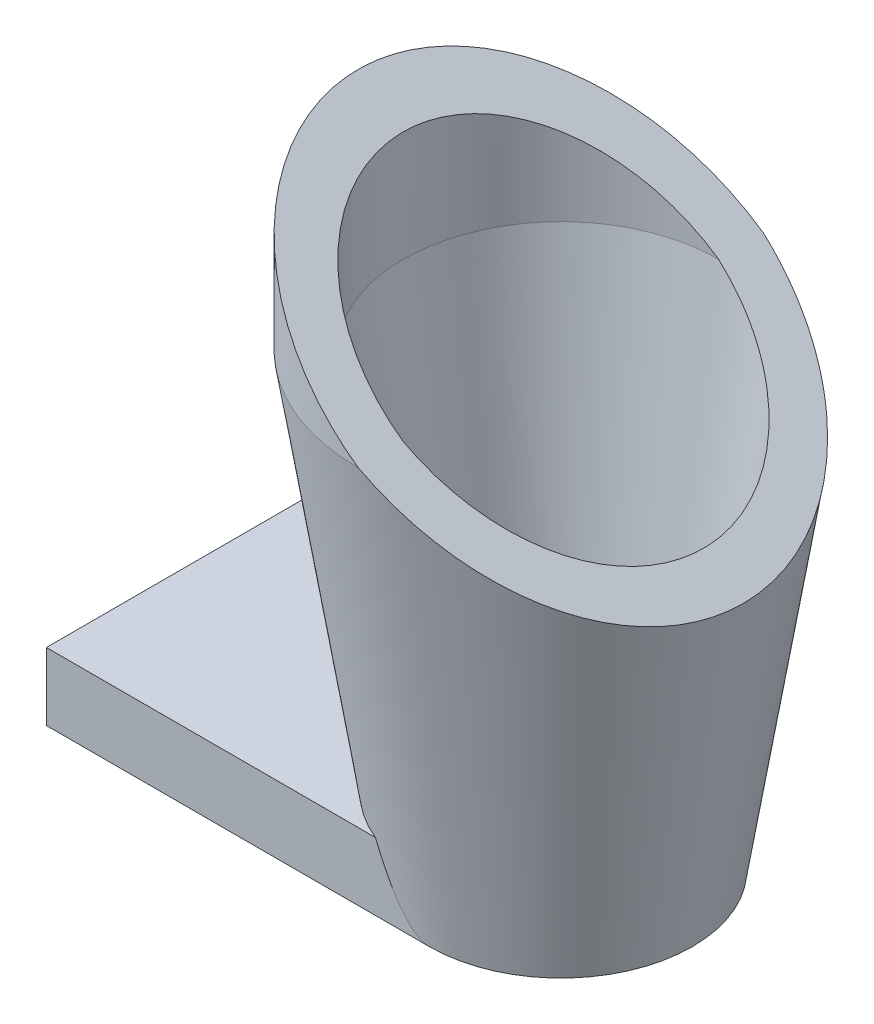
from build123d import *

# Parameters (mm, degrees)
SKETCH1_R                     = 9
BOSS_EXTRUDE1_DEPTH           = 20
BOSS_EXTRUDE1_TAPER           = 9
BOSS_EXTRUDE1_OTHER_WAY_DEPTH = 30
SKETCH1_4_R                   = 7
SKETCH2_R                     = 4
SKETCH1_5_R                   = 7
CUT_EXTRUDE1_DEPTH            = 5
BOSS_EXTRUDE3_DEPTH           = 3


with BuildPart() as part:
    # Sketch1 → Boss-Extrude1 (new body)
    with BuildSketch(Plane(origin=(0, 0, 0), x_dir=(1, 0, 0), z_dir=(0, 1, 0))):
        with Locations(Location((0, 0, 0), (0, 0, 270))):
            Circle(SKETCH1_R)
    extrude(amount=-BOSS_EXTRUDE1_DEPTH, taper=BOSS_EXTRUDE1_TAPER)

    # Sketch1 → Boss-Extrude1 other way (add)
    with BuildSketch(Plane(origin=(0, 0, 0), x_dir=(1, 0, 0), z_dir=(0, 1, 0))):
        with Locations(Location((0, 0, 0), (0, 0, 270))):
            Circle(SKETCH1_R)
    extrude(amount=BOSS_EXTRUDE1_OTHER_WAY_DEPTH)

    # SurfaceCut1
    split(bisect_by=Plane(origin=(0, 0, 0), x_dir=(0, 0, -1), z_dir=(0.5735764363510473, 0.819152044288991, -1.9675099965776456e-15)), keep=Keep.BOTTOM)

    # Sketch1<4> → Cut-Loft1 section 0
    with BuildSketch(Plane(origin=(0, 0, 0), x_dir=(1, 0, 0), z_dir=(0, 1, 0))):
        Circle(SKETCH1_4_R)
    # Sketch2 → Cut-Loft1 section 1
    with BuildSketch(Plane.XZ.offset(20)):
        Circle(SKETCH2_R)
    loft(mode=Mode.SUBTRACT)

    # Sketch1<5> → Cut-Extrude1 (cut)
    with BuildSketch(Plane(origin=(0, 0, 0), x_dir=(1, 0, 0), z_dir=(0, 1, 0))):
        Circle(SKETCH1_5_R)
    extrude(amount=CUT_EXTRUDE1_DEPTH, mode=Mode.SUBTRACT)

    # Sketch3 → Boss-Extrude3 (add)
    with BuildSketch(Plane.XZ.offset(20)):
        with BuildLine():
            ThreePointArc((0, -5.832311194), (-5.832311194, 0), (0, 5.832311194))
            Line((0, 5.832311194), (-17, 5.832311194))
            Line((-17, 5.832311194), (-17, -5.832311194))
            Line((-17, -5.832311194), (0, -5.832311194))
        make_face()
    extrude(amount=-BOSS_EXTRUDE3_DEPTH)


solid = part.part
